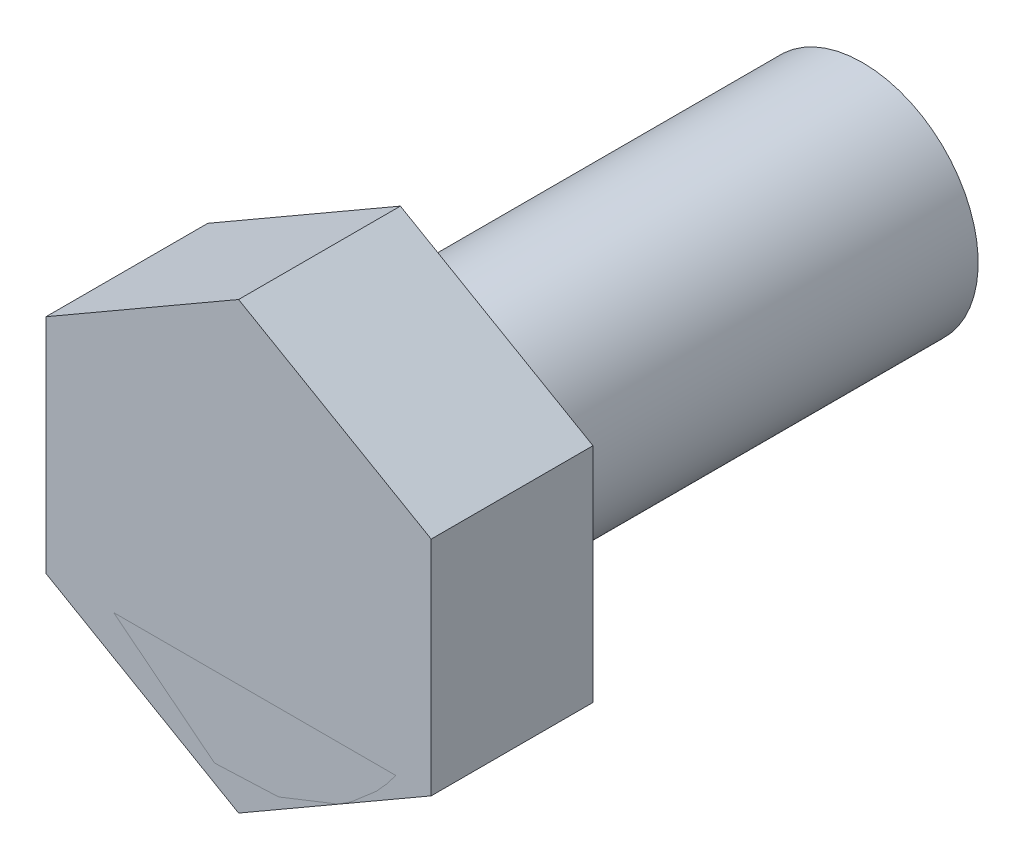
from build123d import *

# Parameters (mm, degrees)
BOSS_EXTRUDE1_DEPTH = 4.2


with BuildPart() as part:
    # Sketch2 → Revolve1 (revolve)
    with BuildSketch(Plane(origin=(0, 0, 0), x_dir=(0, 0, -1), z_dir=(1, 0, 0))):
        Polygon((8.1, 0), (-8.1, 0), (-8.1, 5), (-3.9, 5), (-3.9, 3), (8.1, 3), align=None)
    revolve(axis=Axis((0, 0, -8.1), (0, 0, 1)))


with BuildPart() as body_2:
    # Sketch3 → Boss-Extrude1 (new body)
    with BuildSketch(Plane.XY.offset(8.1)):
        Polygon((0, 5.773502692), (-5, 2.886751346), (-5, -2.886751346), (0, -5.773502692), (5, -2.886751346), (5, 2.886751346), align=None)
    extrude(amount=-BOSS_EXTRUDE1_DEPTH)


solid = Compound([part.part, body_2.part])
